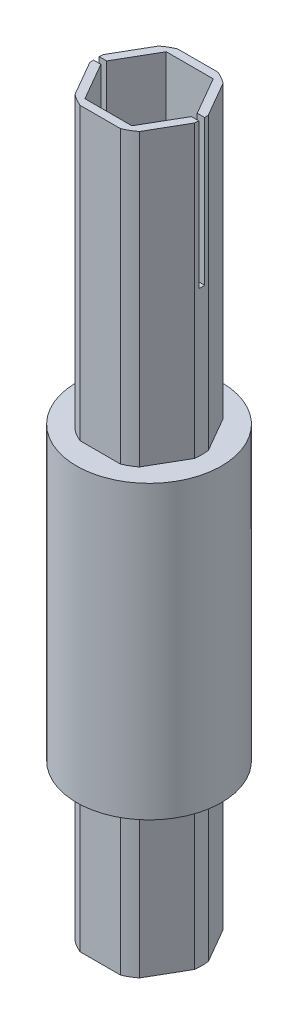
from build123d import *

# Parameters (mm, degrees)
BOSS_EXTRUDE1_DEPTH = 19.812
SKETCH2_R           = 9.5
BOSS_EXTRUDE2_DEPTH = 38.227
BOSS_EXTRUDE6_START = 76.327
BOSS_EXTRUDE6_DEPTH = 76.327
SKETCH6_W           = 13.85
SKETCH6_H           = 0.762
CUT_EXTRUDE1_DEPTH  = 19.05
CUT_EXTRUDE2_DEPTH  = 29.016999878


with BuildPart() as part:
    # Sketch1 → Boss-Extrude1 (new body)
    with BuildSketch(Plane(origin=(0, 0, 0), x_dir=(1, 0, 0), z_dir=(0, 1, 0))):
        with BuildLine():
            Line((6.86474929, 0.911505448), (4.221761519, 5.489294552))
            ThreePointArc((4.221761519, 5.489294552), (3.4625, 5.997225921), (2.642987771, 6.4008))
            Line((2.642987771, 6.4008), (-2.642987771, 6.4008))
            ThreePointArc((-2.642987771, 6.4008), (-3.4625, 5.997225921), (-4.221761519, 5.489294552))
            Line((-4.221761519, 5.489294552), (-6.86474929, 0.911505448))
            ThreePointArc((-6.86474929, 0.911505448), (-6.925, 0), (-6.86474929, -0.911505448))
            Line((-6.86474929, -0.911505448), (-4.221761519, -5.489294552))
            ThreePointArc((-4.221761519, -5.489294552), (-3.4625, -5.997225921), (-2.642987771, -6.4008))
            Line((-2.642987771, -6.4008), (2.642987771, -6.4008))
            ThreePointArc((2.642987771, -6.4008), (3.4625, -5.997225921), (4.221761519, -5.489294552))
            Line((4.221761519, -5.489294552), (6.86474929, -0.911505448))
            ThreePointArc((6.86474929, -0.911505448), (6.925, 0), (6.86474929, 0.911505448))
        make_face()
    extrude(amount=-BOSS_EXTRUDE1_DEPTH)

    # Sketch2 → Boss-Extrude2 (add)
    with BuildSketch(Plane(origin=(0, 0, 0), x_dir=(-1, 0, 0), z_dir=(0, -1, 0))):
        Circle(SKETCH2_R)
    extrude(amount=-BOSS_EXTRUDE2_DEPTH)

    # Sketch1<4> → Boss-Extrude6 (add)
    with BuildSketch(Plane(origin=(0, 0, 0), x_dir=(1, 0, 0), z_dir=(0, 1, 0)).offset(BOSS_EXTRUDE6_START)):
        with BuildLine():
            Line((6.86474929, 0.911505448), (4.221761519, 5.489294552))
            ThreePointArc((4.221761519, 5.489294552), (3.4625, 5.997225921), (2.642987771, 6.4008))
            Line((2.642987771, 6.4008), (-2.642987771, 6.4008))
            ThreePointArc((-2.642987771, 6.4008), (-3.4625, 5.997225921), (-4.221761519, 5.489294552))
            Line((-4.221761519, 5.489294552), (-6.86474929, 0.911505448))
            ThreePointArc((-6.86474929, 0.911505448), (-6.925, 0), (-6.86474929, -0.911505448))
            Line((-6.86474929, -0.911505448), (-4.221761519, -5.489294552))
            ThreePointArc((-4.221761519, -5.489294552), (-3.4625, -5.997225921), (-2.642987771, -6.4008))
            Line((-2.642987771, -6.4008), (2.642987771, -6.4008))
            ThreePointArc((2.642987771, -6.4008), (3.4625, -5.997225921), (4.221761519, -5.489294552))
            Line((4.221761519, -5.489294552), (6.86474929, -0.911505448))
            ThreePointArc((6.86474929, -0.911505448), (6.925, 0), (6.86474929, 0.911505448))
        make_face()
    extrude(amount=-BOSS_EXTRUDE6_DEPTH)

    # Sketch6 → Cut-Extrude1 (cut)
    with BuildSketch(Plane(origin=(0, 76.327, 0), x_dir=(1, 0, 0), z_dir=(0, 1, 0))):
        Rectangle(SKETCH6_W, SKETCH6_H)
    extrude(amount=-CUT_EXTRUDE1_DEPTH, mode=Mode.SUBTRACT)

    # Sketch7 → Cut-Extrude2 (cut)
    with BuildSketch(Plane(origin=(0, 76.327, 0), x_dir=(1, 0, 0), z_dir=(0, 1, 0))):
        Polygon((3.079586336, 5.334), (-3.079586336, 5.334), (-6.159172672, 0), (-3.079586336, -5.334), (3.079586336, -5.334), (6.159172672, 0), align=None)
    extrude(amount=-CUT_EXTRUDE2_DEPTH, mode=Mode.SUBTRACT)


solid = part.part
